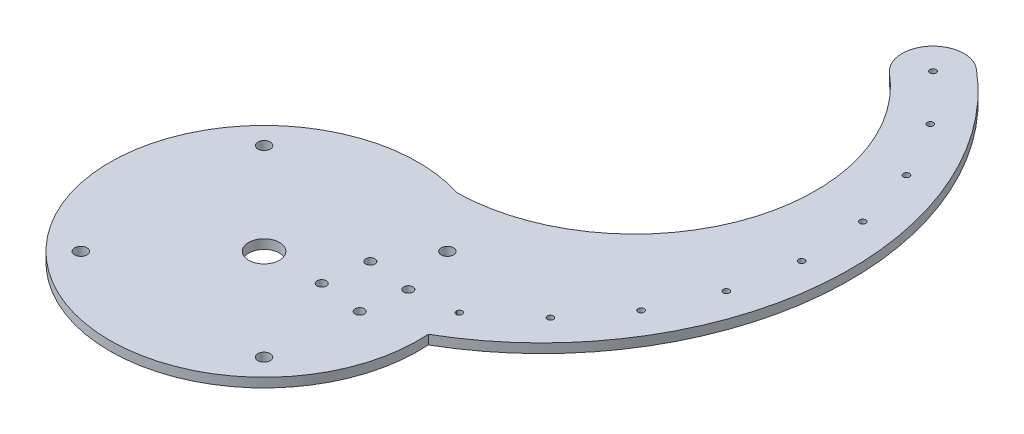
from build123d import *

# Parameters (mm, degrees)
IZIM1_R               = 50
TOP_COVER_DEPTH       = 3
IZIM2_R               = 2
SPACER_DELIKLER_DEPTH = 71.774289117
IZIM4_R               = 5
KES_EKSTR_ZYON3_DEPTH = 71.774289117
IZIM4_3_R             = 1.5
KES_EKSTR_ZYON4_DEPTH = 71.774289117
KANCA_START           = -3
KANCA_DELIKLERI_DEPTH = 3


with BuildPart() as part:
    # Çizim1 → top cover (new body)
    with BuildSketch(Plane(origin=(0, 0, 0), x_dir=(1, 0, 0), z_dir=(0, 1, 0))):
        Circle(IZIM1_R)
    extrude(amount=TOP_COVER_DEPTH)

    # Çizim2 → spacer delikler (cut, through all)
    with BuildSketch(Plane(origin=(0, 3, 0), x_dir=(1, 0, 0), z_dir=(0, 1, 0))):
        with Locations((-29.69848481, 29.69848481)):
            Circle(IZIM2_R)
        with Locations((29.69848481, 29.69848481)):
            Circle(IZIM2_R)
        with Locations((29.69848481, -29.69848481)):
            Circle(IZIM2_R)
        with Locations((-29.69848481, -29.69848481)):
            Circle(IZIM2_R)
    extrude(amount=-SPACER_DELIKLER_DEPTH, mode=Mode.SUBTRACT)

    # Çizim4 → Kes-Ekstrüzyon3 (cut, through all)
    with BuildSketch(Plane(origin=(0, 3, 0), x_dir=(1, 0, 0), z_dir=(0, 1, 0))):
        Circle(IZIM4_R)
    extrude(amount=-KES_EKSTR_ZYON3_DEPTH, mode=Mode.SUBTRACT)

    # Çizim4<3> → Kes-Ekstrüzyon4 (cut, through all)
    with BuildSketch(Plane(origin=(0, 3, 0), x_dir=(1, 0, 0), z_dir=(0, 1, 0))):
        with Locations((34.079267821, 12.675680455)):
            Circle(IZIM4_3_R)
        with Locations((32.362523879, -1.361868841)):
            Circle(IZIM4_3_R)
        with Locations((18.324974583, 0.354875101)):
            Circle(IZIM4_3_R)
        with Locations((20.041718525, 14.392424397)):
            Circle(IZIM4_3_R)
    extrude(amount=-KES_EKSTR_ZYON4_DEPTH, mode=Mode.SUBTRACT)

    # Çizim3 → kanca delikleri (add)
    with BuildSketch(Plane(origin=(0, 3, 0), x_dir=(1, 0, 0), z_dir=(0, 1, 0)).offset(KANCA_START)):
        with BuildLine():
            ThreePointArc((48.06829925, 13.763669832), (49.2554017, 8.596825189), (49.888765157, 3.333333333))
            ThreePointArc((49.888765157, 3.333333333), (99.613854084, 81.220474128), (64.278760969, 166.604444312))
            ThreePointArc((64.278760969, 166.604444312), (50.190440441, 165.371875978), (51.423008775, 151.28355545))
            ThreePointArc((51.423008775, 151.28355545), (69.056591634, 86.88644621), (15, 47.696960071))
            ThreePointArc((15, 47.696960071), (35.531564272, 35.178231058), (47.844482908, 14.522584318))
            ThreePointArc((47.844482908, 14.522584318), (48.609720304, 15.376680878), (49.674237351, 14.950215566))
            ThreePointArc((49.674237351, 14.950215566), (49.795665804, 14.688455458), (49.837297416, 14.402920816))
            ThreePointArc((49.837297416, 14.402920816), (49.177151674, 13.462442702), (48.06829925, 13.763669832))
        make_face()
        with BuildLine():
            ThreePointArc((66.018615213, 27.769945559), (65.40884087, 26.849226309), (64.32316734, 27.051369011))
            ThreePointArc((64.32316734, 27.051369011), (64.296186155, 28.461390608), (65.706036097, 28.496204829))
            ThreePointArc((65.706036097, 28.496204829), (65.937152334, 28.1652803), (66.018615213, 27.769945559))
        make_face(mode=Mode.SUBTRACT)
        with BuildLine():
            ThreePointArc((78.663944618, 44.521304918), (78.158866275, 43.652367317), (77.153839511, 43.661192844))
            ThreePointArc((77.153839511, 43.661192844), (76.8010119, 45.026623752), (78.164461583, 45.387031646))
            ThreePointArc((78.164461583, 45.387031646), (78.530119244, 45.021046368), (78.663944618, 44.521304918))
        make_face(mode=Mode.SUBTRACT)
        with BuildLine():
            ThreePointArc((87.08557892, 63.745988838), (86.678444563, 62.940687448), (85.788558261, 62.791117785))
            ThreePointArc((85.788558261, 62.791117785), (85.129072487, 64.037700073), (86.371971728, 64.704101127))
            ThreePointArc((86.371971728, 64.704101127), (86.887574184, 64.343319229), (87.08557892, 63.745988838))
        make_face(mode=Mode.SUBTRACT)
        with BuildLine():
            ThreePointArc((90.825513882, 84.398477371), (90.508235288, 83.667798589), (89.757730918, 83.400777281))
            ThreePointArc((89.757730918, 83.400777281), (88.827452617, 84.460716511), (89.882207277, 85.396869007))
            ThreePointArc((89.882207277, 85.396869007), (90.552388492, 85.085247567), (90.825513882, 84.398477371))
        make_face(mode=Mode.SUBTRACT)
        with BuildLine():
            ThreePointArc((89.680355962, 105.355600491), (89.443619041, 104.70951267), (88.845497016, 104.369330532))
            ThreePointArc((88.845497016, 104.369330532), (87.695018674, 105.184982708), (88.504266716, 106.339974697))
            ThreePointArc((88.504266716, 106.339974697), (89.322193462, 106.122441168), (89.680355962, 105.355600491))
        make_face(mode=Mode.SUBTRACT)
        with BuildLine():
            ThreePointArc((58.850884872, 158.943999881), (58.789623808, 158.59937079), (58.613346451, 158.296966388))
            ThreePointArc((58.613346451, 158.296966388), (56.912145936, 159.288628972), (58.850884872, 158.943999881))
        make_face(mode=Mode.SUBTRACT)
        with BuildLine():
            ThreePointArc((83.712383709, 125.47762085), (83.545775574, 124.924938302), (83.10146771, 124.556418571))
            ThreePointArc((83.10146771, 124.556418571), (81.793357223, 125.083425063), (82.313088302, 126.394443177))
            ThreePointArc((82.313088302, 126.394443177), (83.260427773, 126.314070313), (83.712383709, 125.47762085))
        make_face(mode=Mode.SUBTRACT)
        with BuildLine():
            ThreePointArc((73.246160797, 143.670217534), (73.138311823, 143.218480281), (72.838027705, 142.864181825))
            ThreePointArc((72.838027705, 142.864181825), (71.443425677, 143.073881783), (71.64537461, 144.469627289))
            ThreePointArc((71.64537461, 144.469627289), (72.692934684, 144.564864444), (73.246160797, 143.670217534))
        make_face(mode=Mode.SUBTRACT)
    extrude(amount=KANCA_DELIKLERI_DEPTH)


solid = part.part
